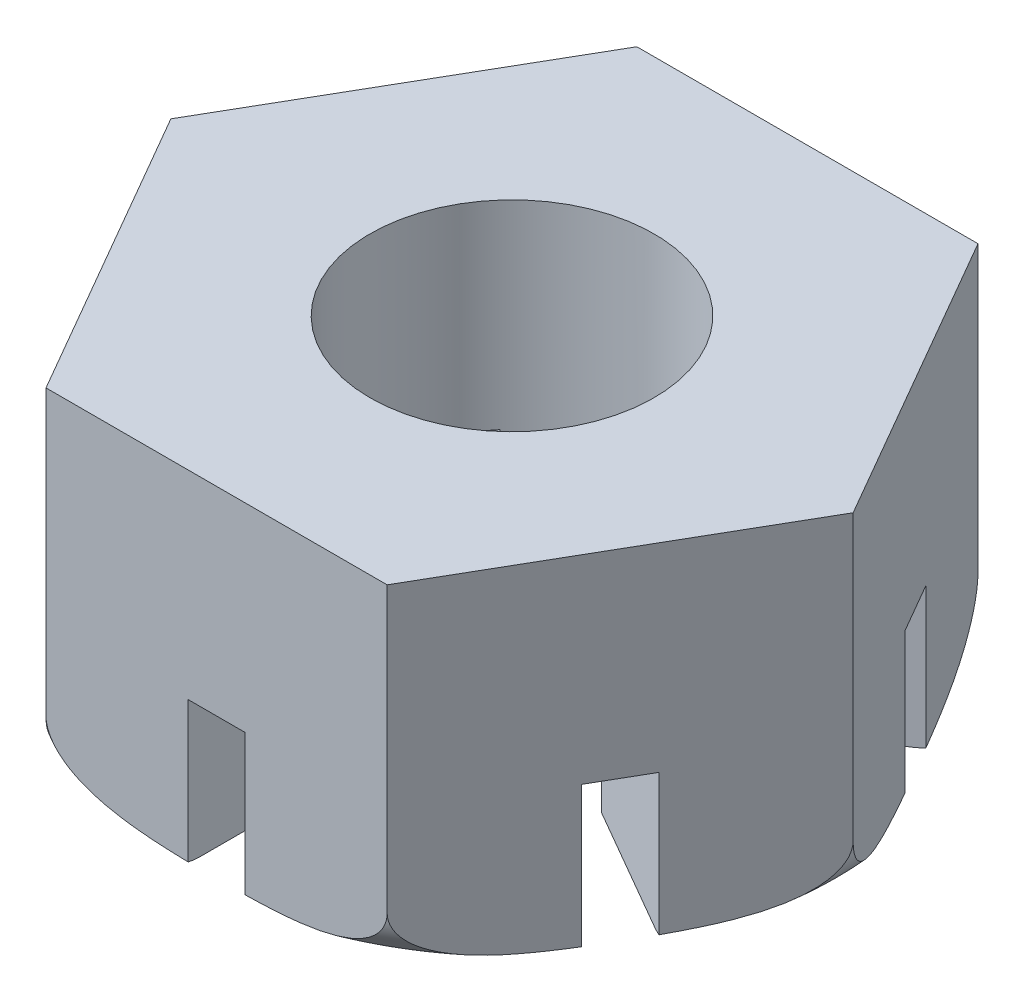
from build123d import *

# Parameters (mm, degrees)
SKETCH1_R           = 25.000506483
BOSS_EXTRUDE1_DEPTH = 60
CUT_EXTRUDE1_START  = -25
CUT_EXTRUDE1_DEPTH  = 25


with BuildPart() as part:
    # Sketch1 → Boss-Extrude1 (new body)
    with BuildSketch(Plane(origin=(0, 0, 0), x_dir=(1, 0, 0), z_dir=(0, 1, 0))):
        Polygon((30.022213998, -52), (60.044427996, 0), (30.022213998, 52), (-30.022213998, 52), (-60.044427996, 0), (-30.022213998, -52), align=None)
        with Locations(Location((0, 0, 0), (0, 0, 270))):
            Circle(SKETCH1_R, mode=Mode.SUBTRACT)
    extrude(amount=-BOSS_EXTRUDE1_DEPTH)

    # Sketch2 → Cut-Extrude1 (cut)
    with BuildSketch(Plane.XZ.offset(60).offset(CUT_EXTRUDE1_START)):
        with BuildLine():
            Line((-5, 52), (-5, 24.495414355))
            ThreePointArc((-5, 24.495414355), (0, 25.000506483), (5, 24.495414355))
            Line((5, 24.495414355), (5, 52))
            Line((5, 52), (-5, 52))
        make_face()
        with BuildLine():
            Line((42.533320997, 30.330127019), (18.713651108, 16.577834196))
            ThreePointArc((18.713651108, 16.577834196), (21.651073722, 12.500253242), (23.713651108, 7.917580159))
            Line((23.713651108, 7.917580159), (47.533320997, 21.669872981))
            Line((47.533320997, 21.669872981), (42.533320997, 30.330127019))
        make_face()
        with BuildLine():
            Line((47.533320997, -21.669872981), (23.713651108, -7.917580159))
            ThreePointArc((23.713651108, -7.917580159), (21.651073722, -12.500253242), (18.713651108, -16.577834196))
            Line((18.713651108, -16.577834196), (42.533320997, -30.330127019))
            Line((42.533320997, -30.330127019), (47.533320997, -21.669872981))
        make_face()
        with BuildLine():
            Line((5, -52), (5, -24.495414355))
            ThreePointArc((5, -24.495414355), (0, -25.000506483), (-5, -24.495414355))
            Line((-5, -24.495414355), (-5, -52))
            Line((-5, -52), (5, -52))
        make_face()
        with BuildLine():
            Line((-42.533320997, -30.330127019), (-18.713651108, -16.577834196))
            ThreePointArc((-18.713651108, -16.577834196), (-21.651073722, -12.500253242), (-23.713651108, -7.917580159))
            Line((-23.713651108, -7.917580159), (-47.533320997, -21.669872981))
            Line((-47.533320997, -21.669872981), (-42.533320997, -30.330127019))
        make_face()
        with BuildLine():
            Line((-47.533320997, 21.669872981), (-23.713651108, 7.917580159))
            ThreePointArc((-23.713651108, 7.917580159), (-21.651073722, 12.500253242), (-18.713651108, 16.577834196))
            Line((-18.713651108, 16.577834196), (-42.533320997, 30.330127019))
            Line((-42.533320997, 30.330127019), (-47.533320997, 21.669872981))
        make_face()
    extrude(amount=CUT_EXTRUDE1_DEPTH, mode=Mode.SUBTRACT)

    # Sketch5 → Cut-Revolve3 (revolve, cut)
    with BuildSketch(Plane.XY):
        with BuildLine():
            Line((60.044427996, -50), (66.995935331, -50))
            Line((66.995935331, -50), (66.995935331, -66.902467868))
            Line((66.995935331, -66.902467868), (50.044427996, -66.902467868))
            Line((50.044427996, -66.902467868), (50.044427996, -60))
            ThreePointArc((50.044427996, -60), (57.115495808, -57.071067812), (60.044427996, -50))
        make_face()
    revolve(axis=Axis((0, 0, 0), (0, -1, 0)), mode=Mode.SUBTRACT)


solid = part.part
